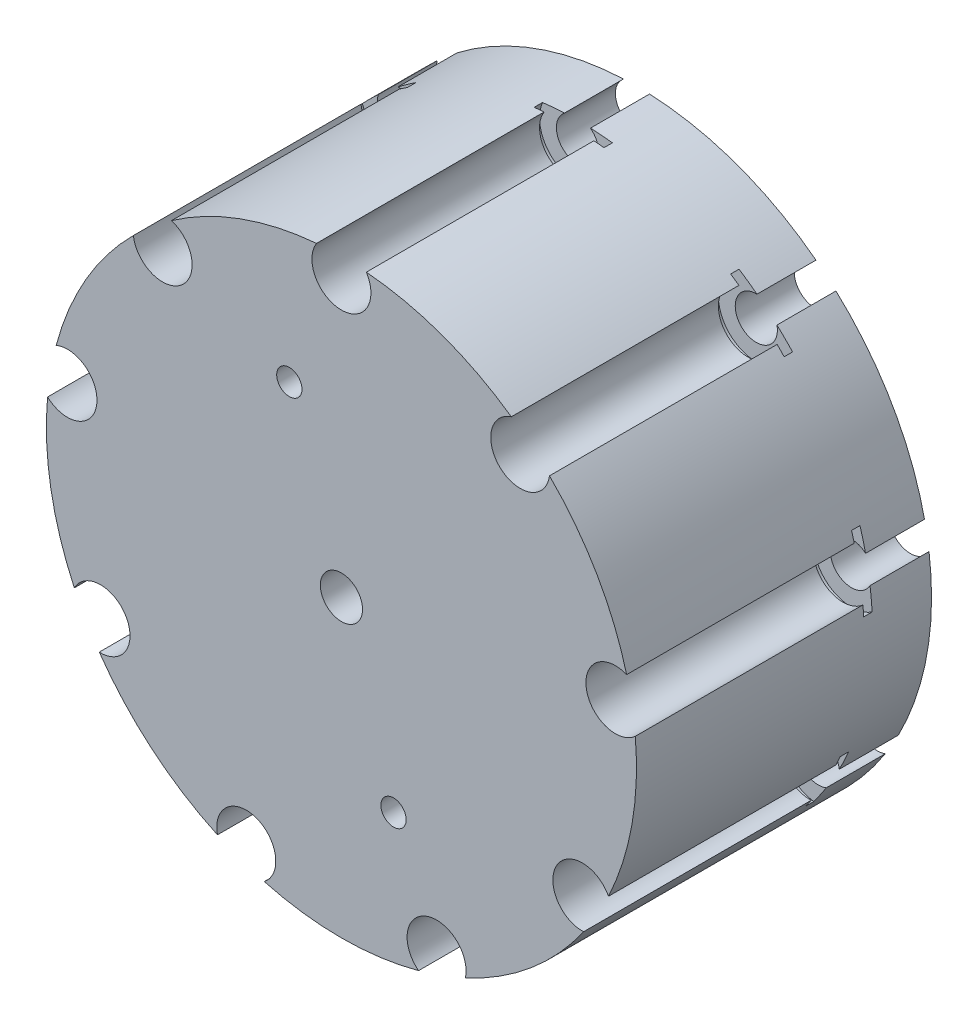
from build123d import *

# Parameters (mm, degrees)
SKETCH_1_R               = 35
SKETCH_1_R_2             = 2.5
EXTRUDE_1_DEPTH          = 35
SKETCH_2_R               = 3.5
CUT_EXTRUDE_1_DEPTH      = 27
SKETCH_3_R               = 2.5
CUT_EXTRUDE_2_DEPTH      = 8
SKETCH_5_R               = 4.5
CUT_EXTRUDE_3_DEPTH      = 1
PATTERN_CIRCULAR_1_COUNT = 9
SKETCH_6_R               = 1.5
CUT_EXTRUDE_4_DEPTH      = 35


with BuildPart() as part:
    # 草图1 → 凸台-拉伸1 (new body)
    with BuildSketch(Plane.XY):
        Circle(SKETCH_1_R)
        Circle(SKETCH_1_R_2, mode=Mode.SUBTRACT)
    extrude(amount=EXTRUDE_1_DEPTH)

    # 草图2 → 切除-拉伸1 (cut)
    with BuildSketch(Plane.XY.offset(35)):
        with Locations((0, 33)):
            Circle(SKETCH_2_R)
    cut_extrude_1 = extrude(amount=-CUT_EXTRUDE_1_DEPTH, mode=Mode.SUBTRACT)

    # 草图3 → 切除-拉伸2 (cut)
    with BuildSketch(Plane.XY.offset(8)):
        with Locations((0, 33)):
            Circle(SKETCH_3_R)
    cut_extrude_2 = extrude(amount=-CUT_EXTRUDE_2_DEPTH, mode=Mode.SUBTRACT)

    # 草图5 → 切除-拉伸3 (cut)
    with BuildSketch(Plane.XY.offset(8)):
        with Locations((0, 33)):
            Circle(SKETCH_5_R)
    cut_extrude_3 = extrude(amount=-CUT_EXTRUDE_3_DEPTH, mode=Mode.SUBTRACT)

    # 阵列(圆周)1: 切除-拉伸1, 切除-拉伸2, 切除-拉伸3 ×9 about axis
    pattern_circular_1_axis = Axis((0, 0, 0), (0, 0, 1))
    add([cut_extrude_1.rotate(pattern_circular_1_axis, i * 360 / PATTERN_CIRCULAR_1_COUNT) for i in range(1, PATTERN_CIRCULAR_1_COUNT)], mode=Mode.SUBTRACT)
    add([cut_extrude_2.rotate(pattern_circular_1_axis, i * 360 / PATTERN_CIRCULAR_1_COUNT) for i in range(1, PATTERN_CIRCULAR_1_COUNT)], mode=Mode.SUBTRACT)
    add([cut_extrude_3.rotate(pattern_circular_1_axis, i * 360 / PATTERN_CIRCULAR_1_COUNT) for i in range(1, PATTERN_CIRCULAR_1_COUNT)], mode=Mode.SUBTRACT)

    # 草图6 → 切除-拉伸4 (cut)
    with BuildSketch(Plane(origin=(0, 0, 0), x_dir=(-1, 0, 0), z_dir=(0, 0, -1))):
        with Locations((6.180339887, 19.021130326)):
            Circle(SKETCH_6_R)
        with Locations((-6.180339887, -19.021130326)):
            Circle(SKETCH_6_R)
    extrude(amount=-CUT_EXTRUDE_4_DEPTH, mode=Mode.SUBTRACT)


solid = part.part
